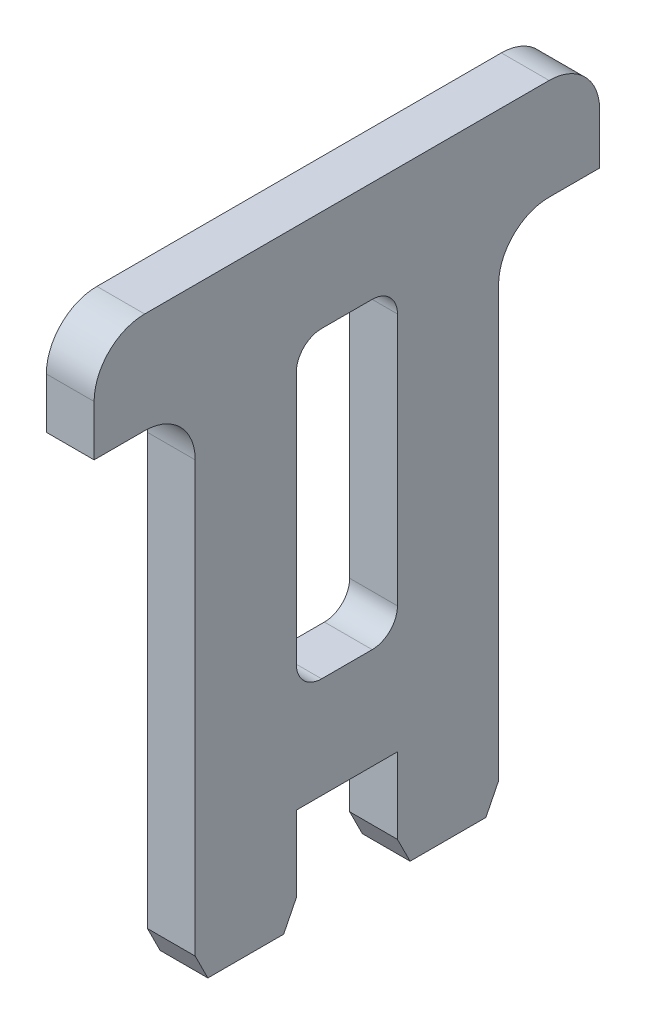
from build123d import *
from OCP.BRepFilletAPI import BRepFilletAPI_MakeChamfer

# Parameters (mm, degrees)
BOSS_EXTRUDE1_DEPTH     = 2.999999969
FILLET1_R               = 6.35
CUT_EXTRUDE1_DEPTH      = 50.956706249
CUT_EXTRUDE1_DEPTH_BACK = 50.956706249
SKETCH2_W               = 12.7
SKETCH2_H               = 38.1
FILLET2_R               = 3.175
CHAMFER1_SIZE           = 3.175
CHAMFER1_SIZE2          = 1.5875
CHAMFER2_SIZE           = 1.5875
CHAMFER2_SIZE2          = 3.175


with BuildPart() as part:
    # Sketch1 → Boss-Extrude1 (new, symmetric)
    with BuildSketch(Plane(origin=(0, 0, 0), x_dir=(0, 0, -1), z_dir=(1, 0, 0))):
        Polygon((-6.35, -25.4), (6.35, -25.4), (6.35, -38.1), (19.05, -38.1), (19.05, -25.4), (19.05, 25.4), (31.75, 25.4), (31.75, 38.1), (-31.75, 38.1), (-31.75, 25.4), (-19.05, 25.4), (-19.05, -25.4), (-19.05, -38.1), (-6.35, -38.1), align=None)
    extrude(amount=BOSS_EXTRUDE1_DEPTH, both=True)

    # Fillet1
    fillet1_edges = [part.edges().sort_by_distance(p)[0] for p in [
        (0, 25.4, -19.05),
        (0, 25.4, 19.05),
        (0, 38.1, 31.75),
        (0, 38.1, -31.75),
    ]]
    fillet(fillet1_edges, radius=FILLET1_R)

    # Sketch2 → Cut-Extrude1 (cut, two sides: drawn at the far end of the back side and taken through both)
    with BuildSketch(Plane(origin=(2.999999969, 0, 0), x_dir=(0, 0, -1), z_dir=(1, 0, 0)).offset(-CUT_EXTRUDE1_DEPTH_BACK)):
        with Locations((0, 6.35)):
            Rectangle(SKETCH2_W, SKETCH2_H)
    extrude(amount=CUT_EXTRUDE1_DEPTH + CUT_EXTRUDE1_DEPTH_BACK, mode=Mode.SUBTRACT)

    # Fillet2
    fillet2_edges = [part.edges().sort_by_distance(p)[0] for p in [
        (0, 25.4, -6.35),
        (0, -12.7, -6.35),
        (0, -12.7, 6.35),
        (0, 25.4, 6.35),
    ]]
    fillet(fillet2_edges, radius=FILLET2_R)

    # Chamfer1: one chamfer whose edges measure the first distance from different faces: ONE call of the kernel's chamfer builder (chamfer() names one face for all edges)
    chamfer1_edges_1 = [part.edges().sort_by_distance(p)[0] for p in [
        (0, -38.1, -6.35),
    ]]
    chamfer1_side_1 = [part.faces().sort_by_distance(p)[0] for p in [
        (0, -31.75, -6.35),
    ]]
    chamfer1_edges_2 = [part.edges().sort_by_distance(p)[0] for p in [
        (0, -38.1, 19.05),
    ]]
    chamfer1_side_2 = [part.faces().sort_by_distance(p)[0] for p in [
        (0, -9.525, 19.05),
    ]]
    chamfer1 = BRepFilletAPI_MakeChamfer(part.part.solid().wrapped)
    for e in chamfer1_edges_1:
        chamfer1.Add(CHAMFER1_SIZE, CHAMFER1_SIZE2, e.wrapped, chamfer1_side_1[0].wrapped)  # the first distance lies on this face
    for e in chamfer1_edges_2:
        chamfer1.Add(CHAMFER1_SIZE, CHAMFER1_SIZE2, e.wrapped, chamfer1_side_2[0].wrapped)  # the first distance lies on this face
    add(Compound.cast(chamfer1.Shape()), mode=Mode.REPLACE)

    # Chamfer2: one chamfer whose edges measure the first distance from different faces: ONE call of the kernel's chamfer builder (chamfer() names one face for all edges)
    chamfer2_edges_1 = [part.edges().sort_by_distance(p)[0] for p in [
        (0, -38.1, -19.05),
    ]]
    chamfer2_side_1 = [part.faces().sort_by_distance(p)[0] for p in [
        (0, -38.1, -13.49375),
    ]]
    chamfer2_edges_2 = [part.edges().sort_by_distance(p)[0] for p in [
        (0, -38.1, 6.35),
    ]]
    chamfer2_side_2 = [part.faces().sort_by_distance(p)[0] for p in [
        (0, -38.1, 11.90625),
    ]]
    chamfer2 = BRepFilletAPI_MakeChamfer(part.part.solid().wrapped)
    for e in chamfer2_edges_1:
        chamfer2.Add(CHAMFER2_SIZE, CHAMFER2_SIZE2, e.wrapped, chamfer2_side_1[0].wrapped)  # the first distance lies on this face
    for e in chamfer2_edges_2:
        chamfer2.Add(CHAMFER2_SIZE, CHAMFER2_SIZE2, e.wrapped, chamfer2_side_2[0].wrapped)  # the first distance lies on this face
    add(Compound.cast(chamfer2.Shape()), mode=Mode.REPLACE)


solid = part.part
